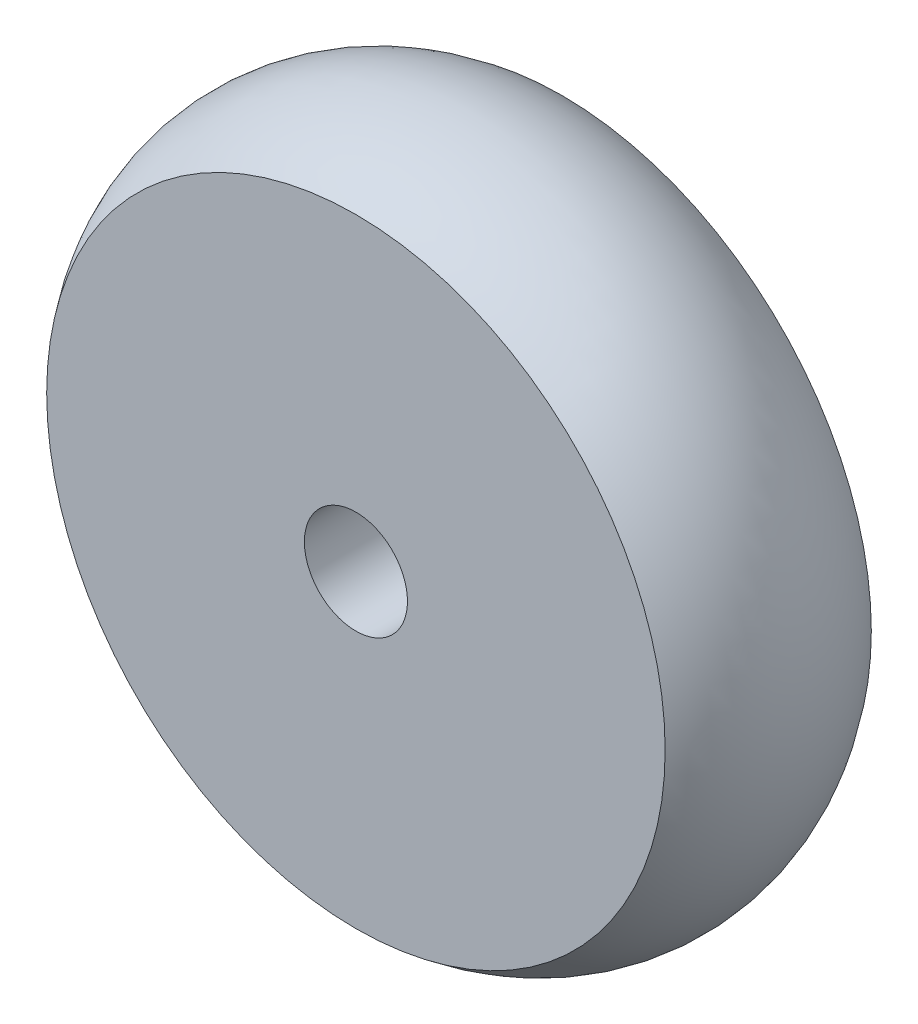
from build123d import *


with BuildPart() as part:
    # Эскиз1 → Повернуть2 (revolve)
    with BuildSketch(Plane(origin=(0, 0, 0), x_dir=(1, 0, 0), z_dir=(0, 1, 0))):
        with BuildLine():
            Line((-4.5, -3), (-0.75, -3))
            Line((-0.75, -3), (-0.75, -1))
            Line((-0.75, -1), (0, -1))
            Line((0, -1), (0, 0))
            Line((0, 0), (-4.5, 0))
            ThreePointArc((-4.5, 0), (-5.026171589, -1.5), (-4.5, -3))
        make_face()
    revolve(axis=Axis((0, 0, 0), (0, 0, 1)))


solid = part.part
